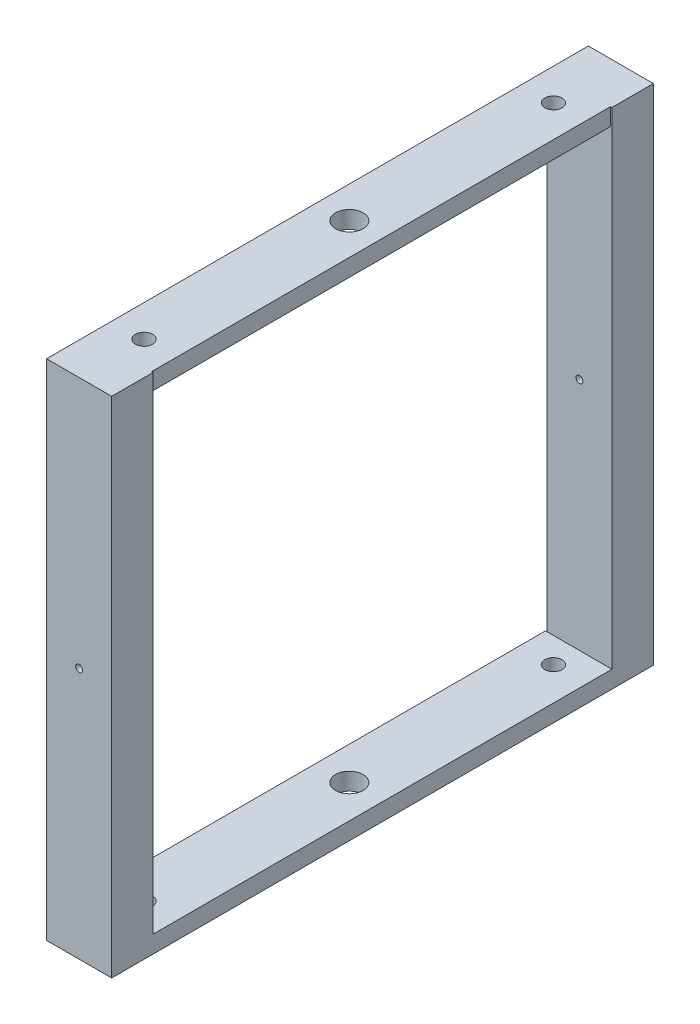
from build123d import *

# Parameters (mm, degrees)
SKETCH1_W            = 133
SKETCH1_H            = 133
BOSS_EXTRUDE2_DEPTH  = 136
SKETCH2_W            = 133
SKETCH2_H            = 118
CUT_EXTRUDE1_DEPTH   = 136
BOSS_EXTRUDE3_DEPTH  = 10.5
SKETCH5_W            = 21
SKETCH5_H            = 3
BOSS_EXTRUDE4_DEPTH  = 23.5
SKETCH6_W            = 42
SKETCH6_H            = 17.2
CUT_EXTRUDE2_DEPTH   = 3
BOSS_EXTRUDE5_DEPTH  = 10.5
SKETCH8_W            = 21
SKETCH8_H            = 3
BOSS_EXTRUDE6_DEPTH  = 23.5
SKETCH9_W            = 42
SKETCH9_H            = 17.2
CUT_EXTRUDE3_DEPTH   = 3
SKETCH10_W           = 19.261488562
SKETCH10_H           = 133
BOSS_EXTRUDE7_DEPTH  = 5
SKETCH11_W           = 18.43727499
SKETCH11_H           = 133
BOSS_EXTRUDE8_DEPTH  = 5
SKETCH12_W           = 18.849381776
SKETCH12_H           = 146
BOSS_EXTRUDE9_DEPTH  = 12
SKETCH14_W           = 18.849381776
SKETCH14_H           = 146
BOSS_EXTRUDE10_DEPTH = 12
SKETCH17_R           = 1
CUT_EXTRUDE4_DEPTH   = 222.251553667
SKETCH18_W           = 133
SKETCH18_H           = 136
CUT_EXTRUDE5_DEPTH   = 170
SKETCH20_R           = 2.5
CUT_EXTRUDE6_DEPTH   = 10
SKETCH22_R           = 2.5
CUT_EXTRUDE8_DEPTH   = 170
SKETCH24_R           = 2.5
CUT_EXTRUDE9_DEPTH   = 170
SKETCH26_R           = 2.474722671
CUT_EXTRUDE10_DEPTH  = 177
SKETCH27_R           = 2.5
CUT_EXTRUDE11_DEPTH  = 177
SKETCH29_R           = 2.5
CUT_EXTRUDE12_DEPTH  = 177
SKETCH31_R           = 4
CUT_EXTRUDE13_DEPTH  = 173


with BuildPart() as part:
    # Sketch1 → Boss-Extrude2 (new body)
    with BuildSketch(Plane(origin=(0, 0, 0), x_dir=(1, 0, 0), z_dir=(0, 1, 0))):
        Rectangle(SKETCH1_W, SKETCH1_H)
    extrude(amount=BOSS_EXTRUDE2_DEPTH)

    # Sketch2 → Cut-Extrude1 (cut)
    with BuildSketch(Plane.XY.offset(66.5)):
        with Locations((0, 68)):
            Rectangle(SKETCH2_W, SKETCH2_H)
    extrude(amount=-CUT_EXTRUDE1_DEPTH, mode=Mode.SUBTRACT)


with BuildPart() as cut_extrude1_piece_1:
    # of the separate pieces the step leaves, piece 1, a body of its own (cut_extrude1_pieces)
    add(part.part.solids().sort_by_distance((-66.5, 0, 66.5))[0])

    # Sketch4 → Boss-Extrude3 (add)
    with BuildSketch(Plane(origin=(0, 9, 0), x_dir=(1, 0, 0), z_dir=(0, 1, 0))):
        Polygon((22.75, -22.75), (43.75, -22.75), (46.25, -22.75), (46.25, -20.25), (20.25, -20.25), (20.25, -46.25), (46.25, -46.25), (46.25, -43.75), (43.75, -43.75), (22.75, -43.75), align=None)
        Polygon((22.75, 43.75), (43.75, 43.75), (46.25, 43.75), (46.25, 46.25), (20.25, 46.25), (20.25, 20.25), (46.25, 20.25), (46.25, 22.75), (43.75, 22.75), (22.75, 22.75), align=None)
    extrude(amount=BOSS_EXTRUDE3_DEPTH)

    # Sketch5 → Boss-Extrude4 (add)
    with BuildSketch(Plane(origin=(22.75, 0, 0), x_dir=(0, 0, -1), z_dir=(1, 0, 0))):
        with Locations((-33.25, 18)):
            Rectangle(SKETCH5_W, SKETCH5_H)
        with Locations((33.25, 18)):
            Rectangle(SKETCH5_W, SKETCH5_H)
    extrude(amount=BOSS_EXTRUDE4_DEPTH)

    # Sketch6 → Cut-Extrude2 (cut)
    with BuildSketch(Plane(origin=(0, 19.5, 0), x_dir=(1, 0, 0), z_dir=(0, 1, 0))):
        with Locations((46.25, -33.25)):
            Rectangle(SKETCH6_W, SKETCH6_H)
        with Locations((46.25, 33.25)):
            Rectangle(SKETCH6_W, SKETCH6_H)
    extrude(amount=-CUT_EXTRUDE2_DEPTH, mode=Mode.SUBTRACT)

    # Sketch10 → Boss-Extrude7 (add)
    with BuildSketch(Plane.XZ):
        Rectangle(SKETCH10_W, SKETCH10_H)
    extrude(amount=BOSS_EXTRUDE7_DEPTH)



with BuildPart() as cut_extrude1_piece_2:
    # of the separate pieces the step leaves, piece 2, a body of its own (cut_extrude1_pieces)
    add(part.part.solids().sort_by_distance((66.5, 127, 66.5))[0])

    # Sketch7 → Boss-Extrude5 (add)
    with BuildSketch(Plane.XZ.offset(-127)):
        Polygon((-43.75, 43.75), (-22.75, 43.75), (-22.75, 22.75), (-43.75, 22.75), (-46.25, 22.75), (-46.25, 20.25), (-20.25, 20.25), (-20.25, 46.25), (-46.25, 46.25), (-46.25, 43.75), align=None)
        Polygon((-43.75, -22.75), (-22.75, -22.75), (-22.75, -43.75), (-43.75, -43.75), (-46.25, -43.75), (-46.25, -46.25), (-20.25, -46.25), (-20.25, -20.25), (-46.25, -20.25), (-46.25, -22.75), align=None)
    extrude(amount=BOSS_EXTRUDE5_DEPTH)

    # Sketch8 → Boss-Extrude6 (add)
    with BuildSketch(Plane.ZY.offset(22.75)):
        with Locations((33.25, 118)):
            Rectangle(SKETCH8_W, SKETCH8_H)
        with Locations((-33.25, 118)):
            Rectangle(SKETCH8_W, SKETCH8_H)
    extrude(amount=BOSS_EXTRUDE6_DEPTH)

    # Sketch9 → Cut-Extrude3 (cut)
    with BuildSketch(Plane.XZ.offset(-116.5)):
        with Locations((-46.25, 33.25)):
            Rectangle(SKETCH9_W, SKETCH9_H)
        with Locations((-46.25, -33.25)):
            Rectangle(SKETCH9_W, SKETCH9_H)
    extrude(amount=-CUT_EXTRUDE3_DEPTH, mode=Mode.SUBTRACT)

    # Sketch11 → Boss-Extrude8 (add)
    with BuildSketch(Plane(origin=(0, 136, 0), x_dir=(1, 0, 0), z_dir=(0, 1, 0))):
        Rectangle(SKETCH11_W, SKETCH11_H)
    extrude(amount=BOSS_EXTRUDE8_DEPTH)


with BuildPart() as cut_extrude1_piece_1_1:
    add(cut_extrude1_piece_1.part)

    add(cut_extrude1_piece_2.part)  # Boss-Extrude9 merges Cut-Extrude1 piece 2
    # Sketch12 → Boss-Extrude9 (add)
    with BuildSketch(Plane(origin=(0, 0, -66.5), x_dir=(-1, 0, 0), z_dir=(0, 0, -1))):
        with Locations((-0.206053393, 68)):
            Rectangle(SKETCH12_W, SKETCH12_H)
    extrude(amount=BOSS_EXTRUDE9_DEPTH)

    # Sketch14 → Boss-Extrude10 (add)
    with BuildSketch(Plane.XY.offset(66.5)):
        with Locations((0.206053393, 68)):
            Rectangle(SKETCH14_W, SKETCH14_H)
    extrude(amount=BOSS_EXTRUDE10_DEPTH)

    # Sketch17 → Cut-Extrude4 (cut, through all)
    with BuildSketch(Plane.XY.offset(78.5)):
        with Locations((0.206053393, 68)):
            Circle(SKETCH17_R)
    extrude(amount=-CUT_EXTRUDE4_DEPTH, mode=Mode.SUBTRACT)

    # Sketch18 → Cut-Extrude5 (cut)
    with BuildSketch(Plane.ZY.offset(66.5)):
        with Locations((0, 68)):
            Rectangle(SKETCH18_W, SKETCH18_H)
    extrude(amount=-CUT_EXTRUDE5_DEPTH, mode=Mode.SUBTRACT)

    # Sketch20 → Cut-Extrude6 (cut)
    with BuildSketch(Plane(origin=(0, 0, 0), x_dir=(1, 0, 0), z_dir=(0, 1, 0))):
        with Locations(Location((0, 0, 0), (0, 0, 270))):
            Circle(SKETCH20_R)
    extrude(amount=-CUT_EXTRUDE6_DEPTH, mode=Mode.SUBTRACT)

    # Sketch22 → Cut-Extrude8 (cut)
    with BuildSketch(Plane(origin=(0, 0, 0), x_dir=(1, 0, 0), z_dir=(0, 1, 0))):
        with Locations(Location((0, 0, 0), (0, 0, 270))):
            Circle(SKETCH22_R)
    extrude(amount=CUT_EXTRUDE8_DEPTH, mode=Mode.SUBTRACT)

    # Sketch24 → Cut-Extrude9 (cut)
    with BuildSketch(Plane(origin=(0, 0, 0), x_dir=(1, 0, 0), z_dir=(0, 1, 0))):
        with Locations(Location((0, 59.159797643, 0), (0, 0, 270))):
            Circle(SKETCH24_R)
    extrude(amount=-CUT_EXTRUDE9_DEPTH, mode=Mode.SUBTRACT)

    # Sketch26 → Cut-Extrude10 (cut)
    with BuildSketch(Plane(origin=(0, 9, 0), x_dir=(1, 0, 0), z_dir=(0, 1, 0))):
        with Locations(Location((0, 59.159797643, 0), (0, 0, 90))):
            Circle(SKETCH26_R)
    extrude(amount=CUT_EXTRUDE10_DEPTH, mode=Mode.SUBTRACT)

    # Sketch27 → Cut-Extrude11 (cut)
    with BuildSketch(Plane(origin=(0, 0, 0), x_dir=(1, 0, 0), z_dir=(0, 1, 0))):
        with Locations(Location((0, -59.499471122, 0), (0, 0, 270))):
            Circle(SKETCH27_R)
    extrude(amount=-CUT_EXTRUDE11_DEPTH, mode=Mode.SUBTRACT)

    # Sketch29 → Cut-Extrude12 (cut)
    with BuildSketch(Plane.XZ.offset(5)):
        with Locations(Location((0, 59.499471122, 0), (0, 0, 90))):
            Circle(SKETCH29_R)
    extrude(amount=-CUT_EXTRUDE12_DEPTH, mode=Mode.SUBTRACT)

    # Sketch31 → Cut-Extrude13 (cut)
    with BuildSketch(Plane(origin=(0, 141, 0), x_dir=(1, 0, 0), z_dir=(0, 1, 0))):
        with Locations(Location((0, 0, 0), (0, 0, 270))):
            Circle(SKETCH31_R)
    extrude(amount=-CUT_EXTRUDE13_DEPTH, mode=Mode.SUBTRACT)


solid = cut_extrude1_piece_1_1.part
